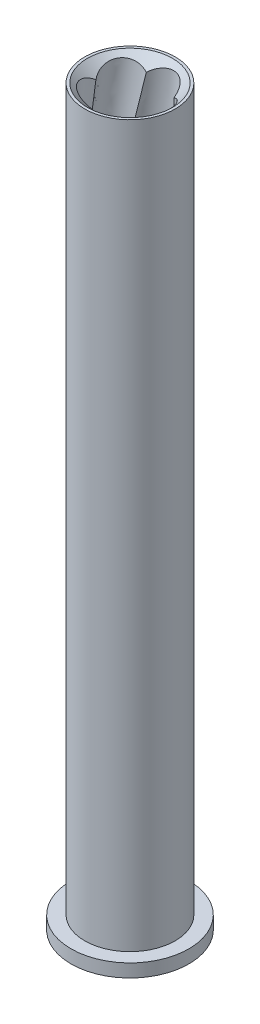
from build123d import *

# Parameters (mm, degrees)
SKETCH1_R              = 4.5
BOSS_EXTRUDE1_DEPTH    = 1
SKETCH2_R              = 3.45
BOSS_EXTRUDE2_DEPTH    = 55
SKETCH3_R              = 2
CUT_EXTRUDE1_DEPTH     = 57.360447124
CHAMFER1_SIZE          = 1
CHAMFER1_SIZE2         = 0.577350269
CUT_SWEEP1_PITCH       = 75
CUT_SWEEP1_HEIGHT      = 100
CUT_SWEEP1_RADIUS      = 2
CUT_SWEEP1_START_ANGLE = -90
SKETCH5_R              = 1.5
CIRPATTERN1_COUNT      = 5


with BuildPart() as part:
    # Sketch1 → Boss-Extrude1 (new body)
    with BuildSketch(Plane(origin=(0, 0, 0), x_dir=(1, 0, 0), z_dir=(0, 1, 0))):
        with Locations(Location((0, 0, 0), (0, 0, 270))):
            Circle(SKETCH1_R)
    extrude(amount=BOSS_EXTRUDE1_DEPTH)

    # Sketch2 → Boss-Extrude2 (add)
    with BuildSketch(Plane(origin=(0, 1, 0), x_dir=(1, 0, 0), z_dir=(0, 1, 0))):
        with Locations(Location((0, 0, 0), (0, 0, 270))):
            Circle(SKETCH2_R)
    extrude(amount=BOSS_EXTRUDE2_DEPTH)

    # Sketch3 → Cut-Extrude1 (cut, through all)
    with BuildSketch(Plane(origin=(0, 56, 0), x_dir=(1, 0, 0), z_dir=(0, 1, 0))):
        with Locations(Location((0, 0, 0), (0, 0, 270))):
            Circle(SKETCH3_R)
    extrude(amount=-CUT_EXTRUDE1_DEPTH, mode=Mode.SUBTRACT)

    # Chamfer1
    chamfer1_edges = [part.edges().sort_by_distance(p)[0] for p in [
        (0, 0, -2),
    ]]
    chamfer1_side = [part.faces().sort_by_distance(p)[0] for p in [
        (0, 28, -2),
    ]]
    chamfer(chamfer1_edges, length=CHAMFER1_SIZE, length2=CHAMFER1_SIZE2, reference=chamfer1_side[0])

    # Cut-Sweep1: sweep along a helix
    with BuildLine() as cut_sweep1_path:
        add(Helix(CUT_SWEEP1_PITCH, CUT_SWEEP1_HEIGHT, CUT_SWEEP1_RADIUS, center=(0, 0, 0), direction=(0, 1, 0), lefthand=True, mode=Mode.PRIVATE).rotate(Axis((0, 0, 0), (0, 1, 0)), CUT_SWEEP1_START_ANGLE))
    # Sketch5 → Cut-Sweep1 (sweep, cut)
    with BuildSketch(Plane(origin=(0, 0, 0), x_dir=(1, 0, 0), z_dir=(0, 1, 0))):
        with Locations((0, -1.4)):
            Circle(SKETCH5_R)
    cut_sweep1 = sweep(path=cut_sweep1_path.line, is_frenet=True, mode=Mode.SUBTRACT)

    # CirPattern1: Cut-Sweep1 ×5 about axis
    cirpattern1_axis = Axis((0, 1, 0), (0, 1, 0))
    for i in range(1, CIRPATTERN1_COUNT):
        add(cut_sweep1.rotate(cirpattern1_axis, i * 360 / CIRPATTERN1_COUNT), mode=Mode.SUBTRACT)

    # Sketch6 → Cut-Revolve1 (revolve, cut)
    with BuildSketch(Plane(origin=(0, 0, 0), x_dir=(0, 0, -1), z_dir=(1, 0, 0)), mode=Mode.PRIVATE) as cut_revolve1_sk:
        Polygon((0, 56), (-3.25, 56), (0, 52.75), align=None)
    revolve(cut_revolve1_sk.sketch.rotate(Axis((0, 1, 0), (0, 1, 0)), 347.341565271), axis=Axis((0, 1, 0), (0, 1, 0)), mode=Mode.SUBTRACT)


solid = part.part
